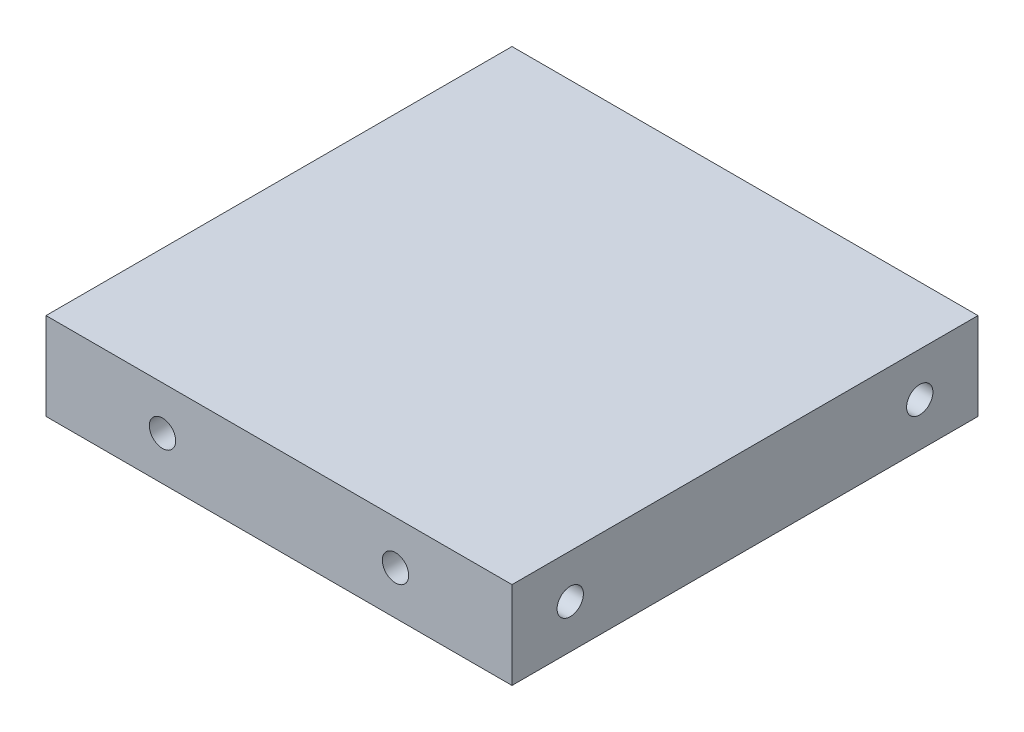
from build123d import *

# Parameters (mm, degrees)
SKETCH1_W                 = 40
SKETCH1_H                 = 40
BOSS_EXTRUDE1_DEPTH       = 7.5
F_4_40_TAPPED_HOLE1_D     = 2.2606
F_4_40_TAPPED_HOLE1_DEPTH = 7.6
F_4_40_TAPPED_HOLE1_TIP   = 0.679152758
F_4_40_TAPPED_HOLE2_D     = 2.2606
F_4_40_TAPPED_HOLE2_DEPTH = 7.6
F_4_40_TAPPED_HOLE2_TIP   = 0.679152758
F_4_40_TAPPED_HOLE3_D     = 2.2606
F_4_40_TAPPED_HOLE3_DEPTH = 7.6
F_4_40_TAPPED_HOLE3_TIP   = 0.679152758
F_4_40_TAPPED_HOLE4_D     = 2.2606
F_4_40_TAPPED_HOLE4_DEPTH = 7.6
F_4_40_TAPPED_HOLE4_TIP   = 0.679152758


with BuildPart() as part:
    # Sketch1 → Boss-Extrude1 (new body)
    with BuildSketch(Plane(origin=(0, 0, 0), x_dir=(1, 0, 0), z_dir=(0, 1, 0))):
        Rectangle(SKETCH1_W, SKETCH1_H)
    extrude(amount=BOSS_EXTRUDE1_DEPTH)

    # #4-40 Tapped Hole1
    with Locations(Plane.ZY.offset(20)):
        with Locations((-15, 3.75), (15, 3.75)):
            Hole(F_4_40_TAPPED_HOLE1_D / 2, depth=F_4_40_TAPPED_HOLE1_DEPTH)
            with Locations((0, 0, -(F_4_40_TAPPED_HOLE1_DEPTH + F_4_40_TAPPED_HOLE1_TIP / 2))):  # 118° drill point
                Cone(0, F_4_40_TAPPED_HOLE1_D / 2, F_4_40_TAPPED_HOLE1_TIP, mode=Mode.SUBTRACT)

    # #4-40 Tapped Hole2
    with Locations(Plane(origin=(20, 0, 0), x_dir=(0, 0, -1), z_dir=(1, 0, 0))):
        with Locations((-15, 3.75), (15, 3.75)):
            Hole(F_4_40_TAPPED_HOLE2_D / 2, depth=F_4_40_TAPPED_HOLE2_DEPTH)
            with Locations((0, 0, -(F_4_40_TAPPED_HOLE2_DEPTH + F_4_40_TAPPED_HOLE2_TIP / 2))):  # 118° drill point
                Cone(0, F_4_40_TAPPED_HOLE2_D / 2, F_4_40_TAPPED_HOLE2_TIP, mode=Mode.SUBTRACT)

    # #4-40 Tapped Hole3
    with Locations(Plane(origin=(0, 0, -20), x_dir=(-1, 0, 0), z_dir=(0, 0, -1))):
        with Locations((-10, 3.75), (10, 3.75)):
            Hole(F_4_40_TAPPED_HOLE3_D / 2, depth=F_4_40_TAPPED_HOLE3_DEPTH)
            with Locations((0, 0, -(F_4_40_TAPPED_HOLE3_DEPTH + F_4_40_TAPPED_HOLE3_TIP / 2))):  # 118° drill point
                Cone(0, F_4_40_TAPPED_HOLE3_D / 2, F_4_40_TAPPED_HOLE3_TIP, mode=Mode.SUBTRACT)

    # #4-40 Tapped Hole4
    with Locations(Plane.XY.offset(20)):
        with Locations((-10, 3.75), (10, 3.75)):
            Hole(F_4_40_TAPPED_HOLE4_D / 2, depth=F_4_40_TAPPED_HOLE4_DEPTH)
            with Locations((0, 0, -(F_4_40_TAPPED_HOLE4_DEPTH + F_4_40_TAPPED_HOLE4_TIP / 2))):  # 118° drill point
                Cone(0, F_4_40_TAPPED_HOLE4_D / 2, F_4_40_TAPPED_HOLE4_TIP, mode=Mode.SUBTRACT)


solid = part.part
